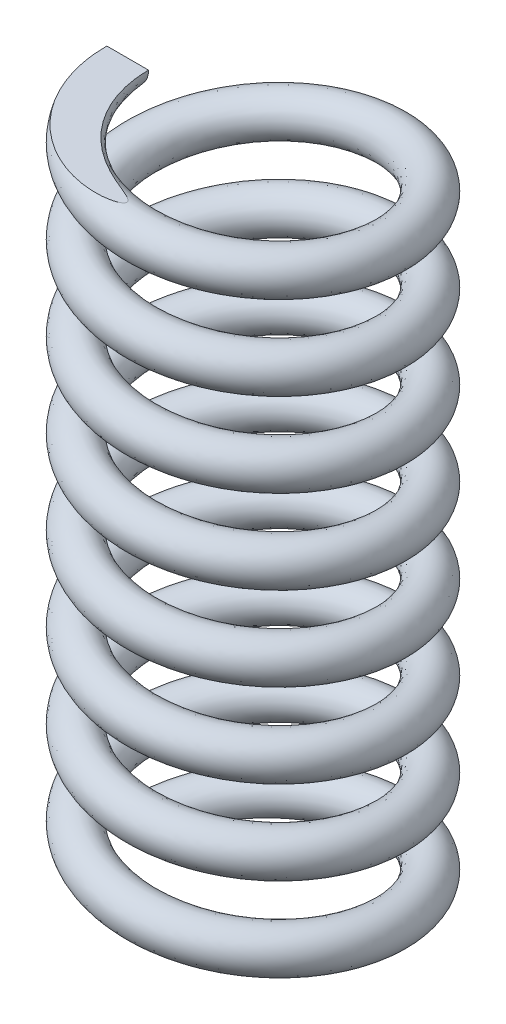
from build123d import *

# Parameters (mm, degrees)
SWEEP1_PITCH       = 6.63
SWEEP1_HEIGHT      = 53.04
SWEEP1_RADIUS      = 9.9
SWEEP1_START_ANGLE = -90
SKETCH4_R          = 1.65
SKETCH6_R          = 20
CUT_EXTRUDE1_DEPTH = 10
SKETCH9_R          = 15
CUT_EXTRUDE2_DEPTH = 10


with BuildPart() as part:
    # Sweep1: sweep along a helix
    with BuildLine() as sweep1_path:
        add(Helix(SWEEP1_PITCH, SWEEP1_HEIGHT, SWEEP1_RADIUS, center=(0, 0, 0), direction=(0, 1, 0), lefthand=True, mode=Mode.PRIVATE).rotate(Axis((0, 0, 0), (0, 1, 0)), SWEEP1_START_ANGLE))
    # Sketch4 → Sweep1 (sweep)
    with BuildSketch(Plane.XY):
        with Locations((-9.9, 0)):
            Circle(SKETCH4_R)
    sweep(path=sweep1_path.line, is_frenet=True)

    # Sketch6 → Cut-Extrude1 (cut)
    with BuildSketch(Plane(origin=(0, 0, 0), x_dir=(1, 0, 0), z_dir=(0, 1, 0))):
        Circle(SKETCH6_R)
    extrude(amount=-CUT_EXTRUDE1_DEPTH, mode=Mode.SUBTRACT)

    # Sketch9 → Cut-Extrude2 (cut)
    with BuildSketch(Plane(origin=(0, 53.04, 0), x_dir=(1, 0, 0), z_dir=(0, 1, 0))):
        Circle(SKETCH9_R)
    extrude(amount=CUT_EXTRUDE2_DEPTH, mode=Mode.SUBTRACT)


solid = part.part
